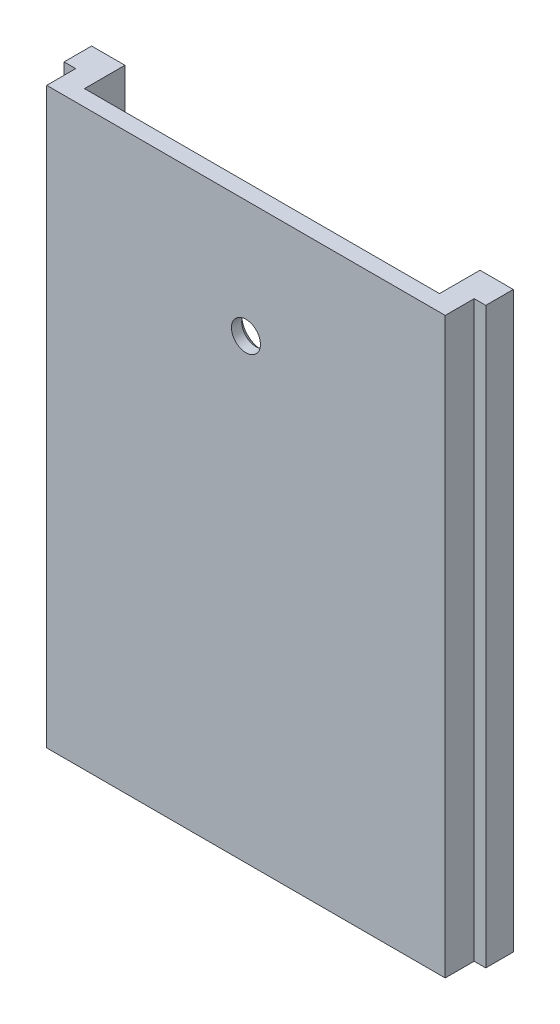
from build123d import *

# Parameters (mm, degrees)
SALIENTE_EXTRUIR4_DEPTH = 198
CROQUIS2_W              = 122.5
CROQUIS2_H              = 3
SALIENTE_EXTRUIR5_DEPTH = 13.963851332
CROQUIS3_R              = 5
CORTAR_EXTRUIR1_DEPTH   = 10
CHAFL_N2_SIZE           = 2


with BuildPart() as part:
    # Croquis1 → Saliente-Extruir4 (new body)
    with BuildSketch(Plane(origin=(0, 0, 0), x_dir=(1, 0, 0), z_dir=(0, 1, 0))):
        Polygon((-4, 10), (-4, 19.5), (7.5, 19.5), (7.5, 5.536148668), (130, 5.536148668), (130, 19.5), (141.5, 19.5), (141.5, 10), (137.5, 10), (137.5, 0), (0, 0), (0, 10), align=None)
    extrude(amount=SALIENTE_EXTRUIR4_DEPTH)

    # Croquis2 → Saliente-Extruir5 (add)
    with BuildSketch(Plane(origin=(0, 0, -5.536148668), x_dir=(-1, 0, 0), z_dir=(0, 0, -1))):
        with Locations((-68.75, 106.5)):
            Rectangle(CROQUIS2_W, CROQUIS2_H)
    extrude(amount=SALIENTE_EXTRUIR5_DEPTH)

    # Croquis3 → Cortar-Extruir1 (cut)
    with BuildSketch(Plane.XY):
        with Locations((68.75, 157.45296568)):
            Circle(CROQUIS3_R)
    extrude(amount=-CORTAR_EXTRUIR1_DEPTH, mode=Mode.SUBTRACT)

    # Chaflán2
    chafl_n2_edges = [part.edges().sort_by_distance(p)[0] for p in [
        (63.75, 157.45296568, -5.536148668),
    ]]
    chamfer(chafl_n2_edges, length=CHAFL_N2_SIZE)


solid = part.part
